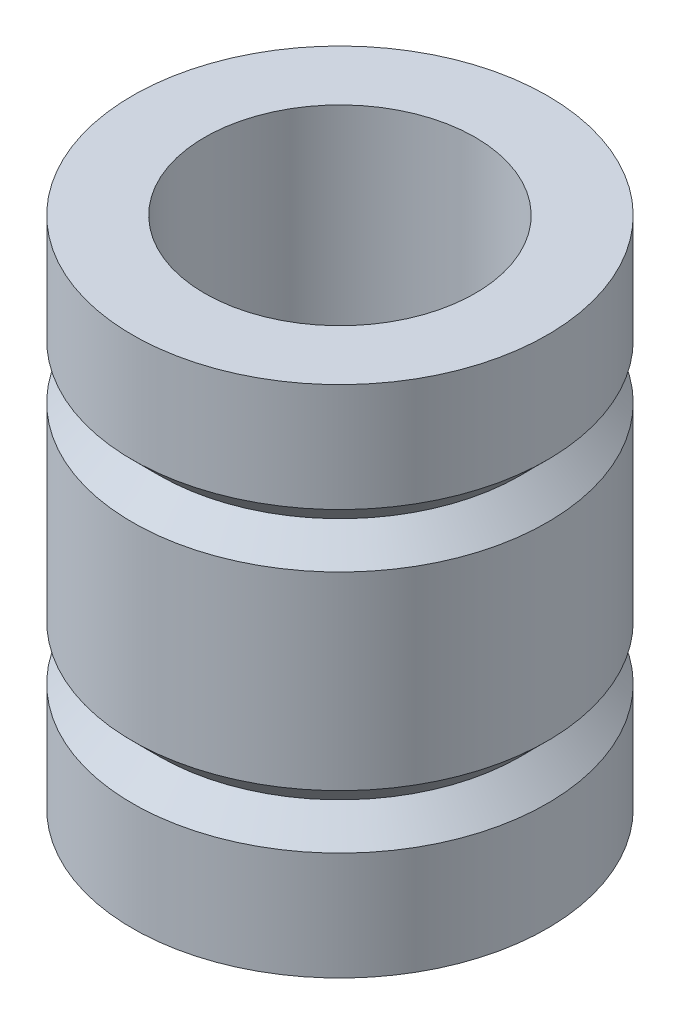
from build123d import *


with BuildPart() as part:
    # Sketch1 → Revolve1 (revolve)
    with BuildSketch(Plane.XY, mode=Mode.PRIVATE) as revolve1_sk:
        Polygon((1.5, 0), (2.3, 0), (2.3, -1.2), (2, -1.5), (2.3, -1.8), (2.3, -3.9), (2, -4.2), (2.3, -4.5), (2.3, -5.7), (1.5, -5.7), align=None)
    revolve(revolve1_sk.sketch.rotate(Axis((0, -10, 0), (0, 1, 0)), 90), axis=Axis((0, -10, 0), (0, 1, 0)))


solid = part.part
